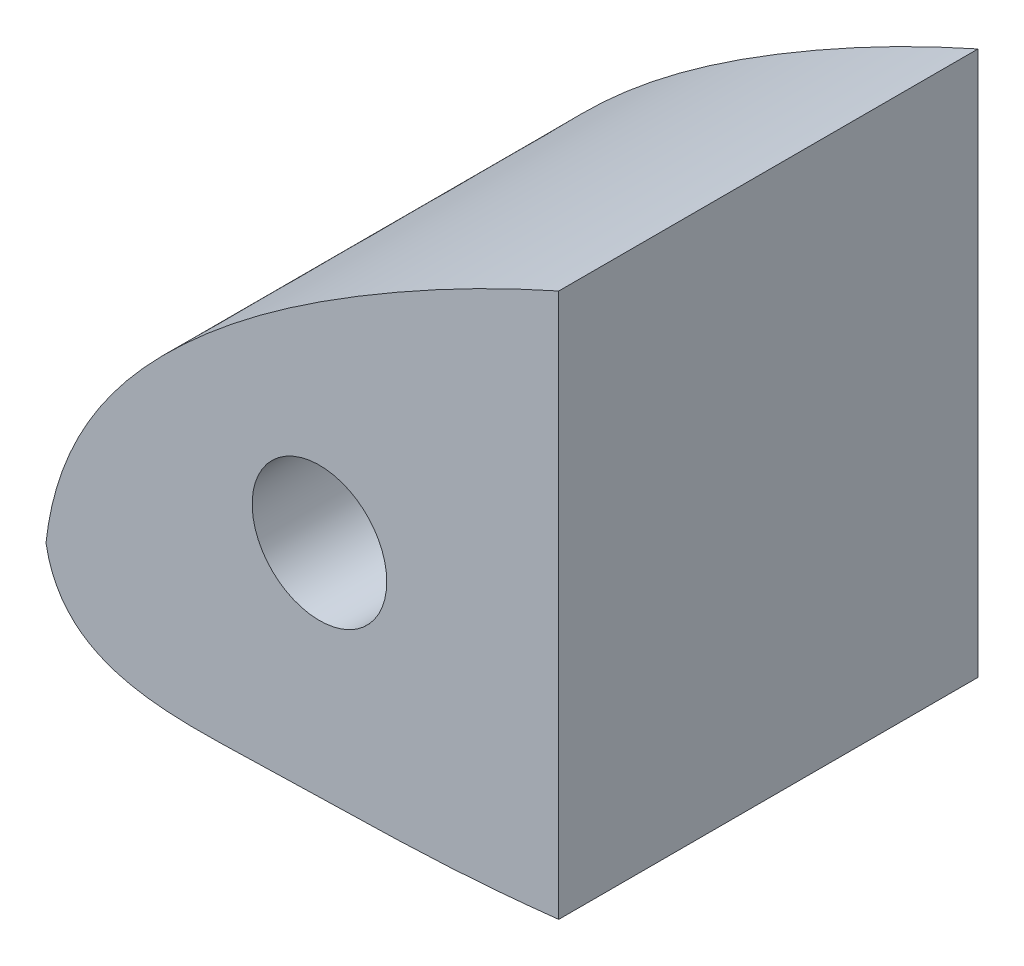
from build123d import *

# Parameters (mm, degrees)
BOSS_EXTRUDE1_DEPTH = 31.1531
SKETCH2_R           = 5
SKETCH2_R_2         = 3.175
CUT_EXTRUDE1_DEPTH  = 318.261218693
SKETCH3_W           = 293.188888759
SKETCH3_H           = 137.971241769
CUT_EXTRUDE2_DEPTH  = 318.261218693


with BuildPart() as part:
    # Sketch1 → Boss-Extrude1 (new body)
    with BuildSketch(Plane.XY):
        with BuildLine():
            add(Edge.make_bspline(
                [(0.000560351, 0.000130087), (0.810633127, 7.359196055), (8.649092025, 17.856605174), (26.286719818, 29.975176328), (52.111128271, 42.069215275), (89.597618475, 49.290763054), (131.400792109, 47.884831915), (173.256699242, 40.041104278), (217.961060472, 29.612974894), (256.952064401, 19.528920948), (290.35983767, 8.71099439), (301.273197721, 4.382828139), (314.816918223, -0.516206742), (309.846313895, 0.000130087)],
                knots=[0, 0, 0, 0, 0.060863618, 0.113688265, 0.188608742, 0.312908923, 0.448482434, 0.557612135, 0.691544113, 0.852438279, 0.92975597, 0.976058229, 1, 1, 1, 1], degree=3))
            add(Edge.make_bspline(
                [(309.846313895, 0.000130087), (303.956832565, 1.47095521), (293.989507544, 2.093987313), (276.26402299, 4.514356704), (260.846344817, 5.427413394), (235.858814759, 7.870306192), (205.101424636, 8.838080282), (157.718638092, 9.030650149), (110.497331172, 6.181495223), (66.506197185, -0.586669107), (36.454672816, -6.098499901), (15.316603331, -6.189065841), (1.230714189, -6.924076091), (0.000560351, 0.000130087)],
                knots=[0, 0, 0, 0, 0.057787081, 0.095274891, 0.171021118, 0.205339302, 0.335319146, 0.464904334, 0.658702312, 0.785511947, 0.893517288, 0.94309214, 1, 1, 1, 1], degree=3))
        make_face()
    extrude(amount=BOSS_EXTRUDE1_DEPTH)

    # Sketch2 → Cut-Extrude1 (cut, through all)
    with BuildSketch(Plane.XY.offset(31.1531)):
        with Locations((20.32, 10.16)):
            Circle(SKETCH2_R)
        with Locations((227.296313895, 19.050130087)):
            Circle(SKETCH2_R_2)
    extrude(amount=-CUT_EXTRUDE1_DEPTH, mode=Mode.SUBTRACT)

    # Sketch3 → Cut-Extrude2 (cut, through all)
    with BuildSketch(Plane.XY.offset(31.1531)):
        with Locations((184.69444438, 2.732377951)):
            Rectangle(SKETCH3_W, SKETCH3_H)
    extrude(amount=-CUT_EXTRUDE2_DEPTH, mode=Mode.SUBTRACT)


solid = part.part
